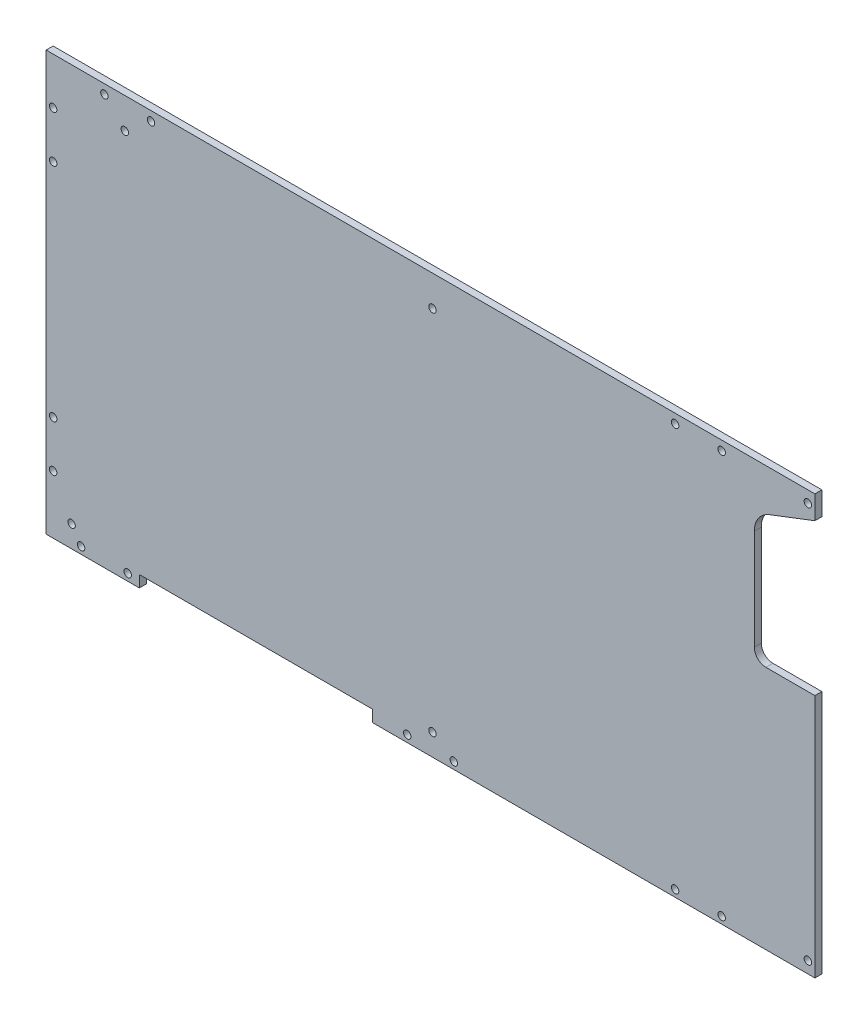
from build123d import *

# Parameters (mm, degrees)
SKETCH_1_W          = 330
SKETCH_1_H          = 180
EXTRUDE_1_DEPTH     = 3
SKETCH_2_R          = 1.6
CUT_EXTRUDE_1_DEPTH = 376.910893697
SKETCH_3_R          = 1.6
CUT_EXTRUDE_2_DEPTH = 376.910893697
CUT_EXTRUDE_3_REACH = 377.911
SKETCH_4_W          = 100
SKETCH_4_H          = 5
CUT_EXTRUDE_4_REACH = 377.911


with BuildPart() as part:
    # 草图1 → 凸台-拉伸1 (new body)
    with BuildSketch(Plane.XY):
        with Locations((165, 90)):
            Rectangle(SKETCH_1_W, SKETCH_1_H)
    extrude(amount=EXTRUDE_1_DEPTH)

    # 草图2 → 切除-拉伸1 (cut, through all)
    with BuildSketch(Plane.XY.offset(3)):
        with Locations((33.77, 166.83)):
            Circle(SKETCH_2_R)
        with Locations((165.85, 166.83)):
            Circle(SKETCH_2_R)
        with Locations((10.91, 9.35)):
            Circle(SKETCH_2_R)
        with Locations((165.85, 9.35)):
            Circle(SKETCH_2_R)
    extrude(amount=-CUT_EXTRUDE_1_DEPTH, mode=Mode.SUBTRACT)

    # 草图3 → 切除-拉伸2 (cut, through all)
    with BuildSketch(Plane.XY.offset(3)):
        with Locations((3, 160)):
            Circle(SKETCH_3_R)
        with Locations((3, 140)):
            Circle(SKETCH_3_R)
        with Locations((3, 45)):
            Circle(SKETCH_3_R)
        with Locations((3, 25)):
            Circle(SKETCH_3_R)
        with Locations((15, 3)):
            Circle(SKETCH_3_R)
        with Locations((35, 3)):
            Circle(SKETCH_3_R)
        with Locations((155, 3)):
            Circle(SKETCH_3_R)
        with Locations((175, 3)):
            Circle(SKETCH_3_R)
        with Locations((25, 176)):
            Circle(SKETCH_3_R)
        with Locations((45, 176)):
            Circle(SKETCH_3_R)
        with Locations((270, 176)):
            Circle(SKETCH_3_R)
        with Locations((290, 176)):
            Circle(SKETCH_3_R)
        with Locations((270, 3)):
            Circle(SKETCH_3_R)
        with Locations((290, 3)):
            Circle(SKETCH_3_R)
        with Locations((327, 5)):
            Circle(SKETCH_3_R)
        with Locations((327, 175)):
            Circle(SKETCH_3_R)
    extrude(amount=-CUT_EXTRUDE_2_DEPTH, mode=Mode.SUBTRACT)

    # 草图4 → 切除-拉伸3 (cut, up to next)
    with BuildSketch(Plane.XY.offset(3), mode=Mode.PRIVATE) as cut_extrude_3_sk1:
        with Locations((90, 2.5)):
            Rectangle(SKETCH_4_W, SKETCH_4_H)
    cut_extrude_3_tool1 = extrude(cut_extrude_3_sk1.sketch, amount=-CUT_EXTRUDE_3_REACH, mode=Mode.PRIVATE) & part.part
    add(cut_extrude_3_tool1.solids().sort_by_distance((90, 2.5, 3))[0], mode=Mode.SUBTRACT)

    # 草图6 → 切除-拉伸4 (cut, up to next)
    with BuildSketch(Plane.XY.offset(3), mode=Mode.PRIVATE) as cut_extrude_4_sk1:
        with BuildLine():
            Line((330, 170), (330, 105))
            Line((330, 105), (309, 105))
            ThreePointArc((309, 105), (305.464466094, 106.464466094), (304, 110))
            Line((304, 110), (304, 153.132009018))
            ThreePointArc((304, 153.132009018), (305.75688445, 158.793373344), (310.410209207, 162.46546508))
            Line((310.410209207, 162.46546508), (330, 170))
        make_face()
    cut_extrude_4_tool1 = extrude(cut_extrude_4_sk1.sketch, amount=-CUT_EXTRUDE_4_REACH, mode=Mode.PRIVATE) & part.part
    add(cut_extrude_4_tool1.solids().sort_by_distance((317.469531, 135.038029, 3))[0], mode=Mode.SUBTRACT)


solid = part.part
